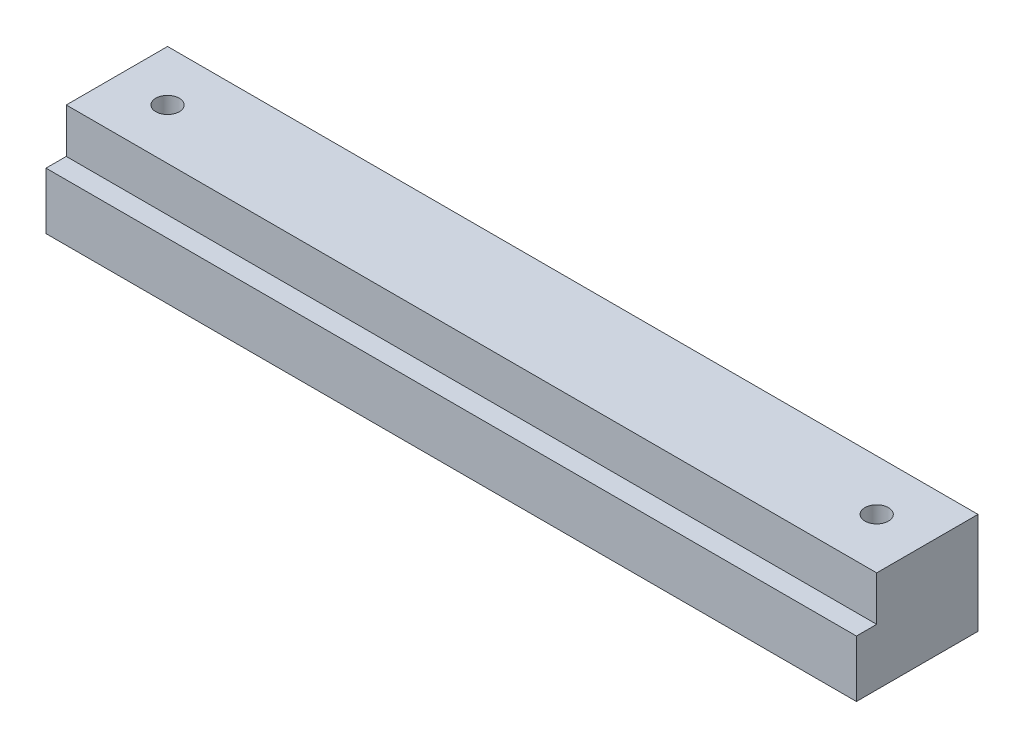
from build123d import *

# Parameters (mm, degrees)
SKETCH1_W                   = 101.6
SKETCH1_H                   = 12.7
BOSS_EXTRUDE1_DEPTH         = 12.7
F_32_0_116_DIAMETER_HOLE1_D = 2.9464
SKETCH5_W                   = 101.6
SKETCH5_H                   = 7.112
BOSS_EXTRUDE2_DEPTH         = 2.54


with BuildPart() as part:
    # Sketch1 → Boss-Extrude1 (new body)
    with BuildSketch(Plane(origin=(0, 0, 0), x_dir=(1, 0, 0), z_dir=(0, 1, 0))):
        with Locations((50.8, 6.35)):
            Rectangle(SKETCH1_W, SKETCH1_H)
    extrude(amount=BOSS_EXTRUDE1_DEPTH)

    # #32 (0.116) Diameter Hole1 (through all)
    with Locations(Plane(origin=(0, 12.7, 0), x_dir=(1, 0, 0), z_dir=(0, 1, 0))):
        with Locations((6.35, 6.35), (95.25, 6.35)):
            Hole(F_32_0_116_DIAMETER_HOLE1_D / 2)

    # Sketch5 → Boss-Extrude2 (add)
    with BuildSketch(Plane.XY):
        with Locations((50.8, 3.556)):
            Rectangle(SKETCH5_W, SKETCH5_H)
    extrude(amount=BOSS_EXTRUDE2_DEPTH)


solid = part.part
